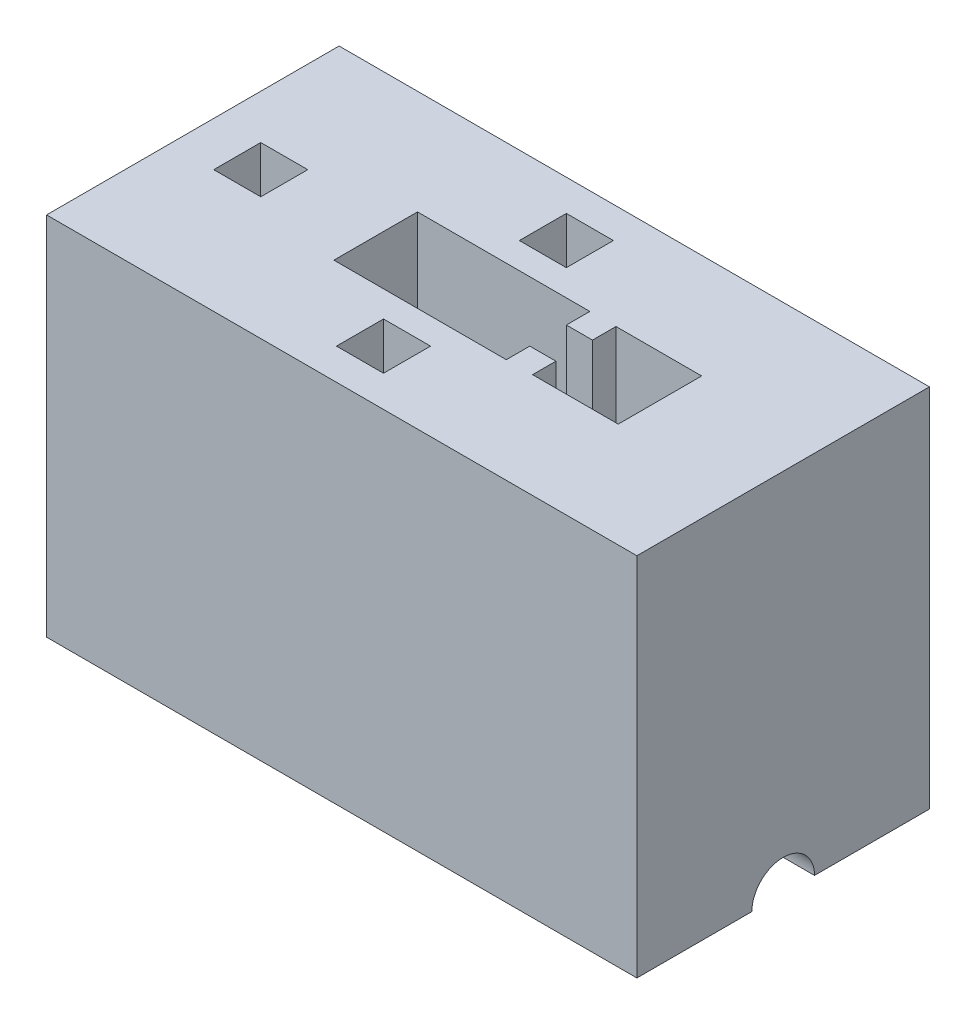
from build123d import *

# Parameters (mm, degrees)
SKETCH1_W                = 143.51
SKETCH1_H                = 121.92
BIG_BLOCK_DEPTH          = 88.9
SERVO_CUTOUT_DEPTH       = 25.654
SKETCH3_W                = 121.92
SKETCH3_H                = 55.88
CUT_EXTRUDE2_DEPTH       = 50.8
CUT_EXTRUDE18_DEPTH      = 172.184986353
CUT_EXTRUDE18_DEPTH_BACK = 48.26
SKETCH6_W                = 20.822928363
SKETCH6_H                = 20.278092026
SKETCH10_W               = 11.43
SKETCH10_H               = 11.43
CUT_EXTRUDE19_DEPTH      = 187.082964166
SKETCH11_W               = 11.43
SKETCH11_H               = 11.43
CUT_EXTRUDE20_DEPTH      = 187.082964166
SKETCH9_W                = 11.43
SKETCH9_H                = 11.43
CUT_EXTRUDE22_DEPTH      = 187.082964166
SKETCH12_W               = 143.51
SKETCH12_H               = 25.4
REMOVESIDES_DEPTH        = 187.082964166
CUT_EXTRUDE23_DEPTH      = 189.901333259
CUT_EXTRUDE23_DEPTH_BACK = 189.901333259


with BuildPart() as part:
    # Sketch1 → Big Block (new body)
    with BuildSketch(Plane(origin=(0, 0, 0), x_dir=(1, 0, 0), z_dir=(0, 1, 0))):
        with Locations((-49.021531365, -49.206642066)):
            Rectangle(SKETCH1_W, SKETCH1_H)
    extrude(amount=BIG_BLOCK_DEPTH)

    # Sketch2 → Servo Cutout (cut)
    with BuildSketch(Plane(origin=(0, 88.9, 0), x_dir=(1, 0, 0), z_dir=(0, 1, 0))):
        Polygon((-76.326531365, -39.046642066), (-34.416531365, -39.046642066), (-34.416531365, -44.761642066), (-19.176531365, -44.761642066), (-19.176531365, -53.651642066), (-34.416531365, -53.651642066), (-34.416531365, -59.366642066), (-76.326531365, -59.366642066), align=None)
    extrude(amount=-SERVO_CUTOUT_DEPTH, mode=Mode.SUBTRACT)

    # Sketch3 → Cut-Extrude2 (cut)
    with BuildSketch(Plane(origin=(0, 0, 0), x_dir=(-1, 0, 0), z_dir=(0, -1, 0))):
        with Locations((49.021531365, -49.206642066)):
            Rectangle(SKETCH3_W, SKETCH3_H)
    extrude(amount=-CUT_EXTRUDE2_DEPTH, mode=Mode.SUBTRACT)

    # Sketch6 → Cut-Extrude18 (cut, two sides: drawn at the far end of the back side and taken through both)
    with BuildSketch(Plane.XZ.offset(-50.8).offset(-CUT_EXTRUDE18_DEPTH_BACK)):
        with Locations((-17.655067184, 49.185688079)):
            Rectangle(SKETCH6_W, SKETCH6_H)
    extrude(amount=CUT_EXTRUDE18_DEPTH + CUT_EXTRUDE18_DEPTH_BACK, mode=Mode.SUBTRACT)

    # Sketch10 → Cut-Extrude19 (cut, through all)
    with BuildSketch(Plane(origin=(0, 88.9, 0), x_dir=(1, 0, 0), z_dir=(0, 1, 0))):
        with Locations((-52.196531365, -26.981642066)):
            Rectangle(SKETCH10_W, SKETCH10_H)
    extrude(amount=-CUT_EXTRUDE19_DEPTH, mode=Mode.SUBTRACT)

    # Sketch11 → Cut-Extrude20 (cut, through all)
    with BuildSketch(Plane(origin=(0, 88.9, 0), x_dir=(1, 0, 0), z_dir=(0, 1, 0))):
        with Locations((-52.196531365, -71.431642066)):
            Rectangle(SKETCH11_W, SKETCH11_H)
    extrude(amount=-CUT_EXTRUDE20_DEPTH, mode=Mode.SUBTRACT)

    # Sketch9 → Cut-Extrude22 (cut, through all)
    with BuildSketch(Plane(origin=(0, 88.9, 0), x_dir=(1, 0, 0), z_dir=(0, 1, 0))):
        with Locations((-104.266531365, -49.206642066)):
            Rectangle(SKETCH9_W, SKETCH9_H)
    extrude(amount=-CUT_EXTRUDE22_DEPTH, mode=Mode.SUBTRACT)

    # Sketch12 → removesides (cut, through all)
    with BuildSketch(Plane(origin=(0, 0, 0), x_dir=(-1, 0, 0), z_dir=(0, -1, 0))):
        with Locations((49.021531365, -97.466642066)):
            Rectangle(SKETCH12_W, SKETCH12_H)
        with Locations((49.021531365, -0.946642066)):
            Rectangle(SKETCH12_W, SKETCH12_H)
    extrude(amount=-REMOVESIDES_DEPTH, mode=Mode.SUBTRACT)

    # Sketch13 → Cut-Extrude23 (cut, two sides: drawn at the far end of the back side and taken through both)
    with BuildSketch(Plane.ZY.offset(120.776531365).offset(-CUT_EXTRUDE23_DEPTH_BACK)):
        with BuildLine():
            Line((41.586642066, 0), (56.826642066, 0))
            ThreePointArc((56.826642066, 0), (49.206642066, 7.62), (41.586642066, 0))
        make_face()
    extrude(amount=CUT_EXTRUDE23_DEPTH + CUT_EXTRUDE23_DEPTH_BACK, mode=Mode.SUBTRACT)


solid = part.part
